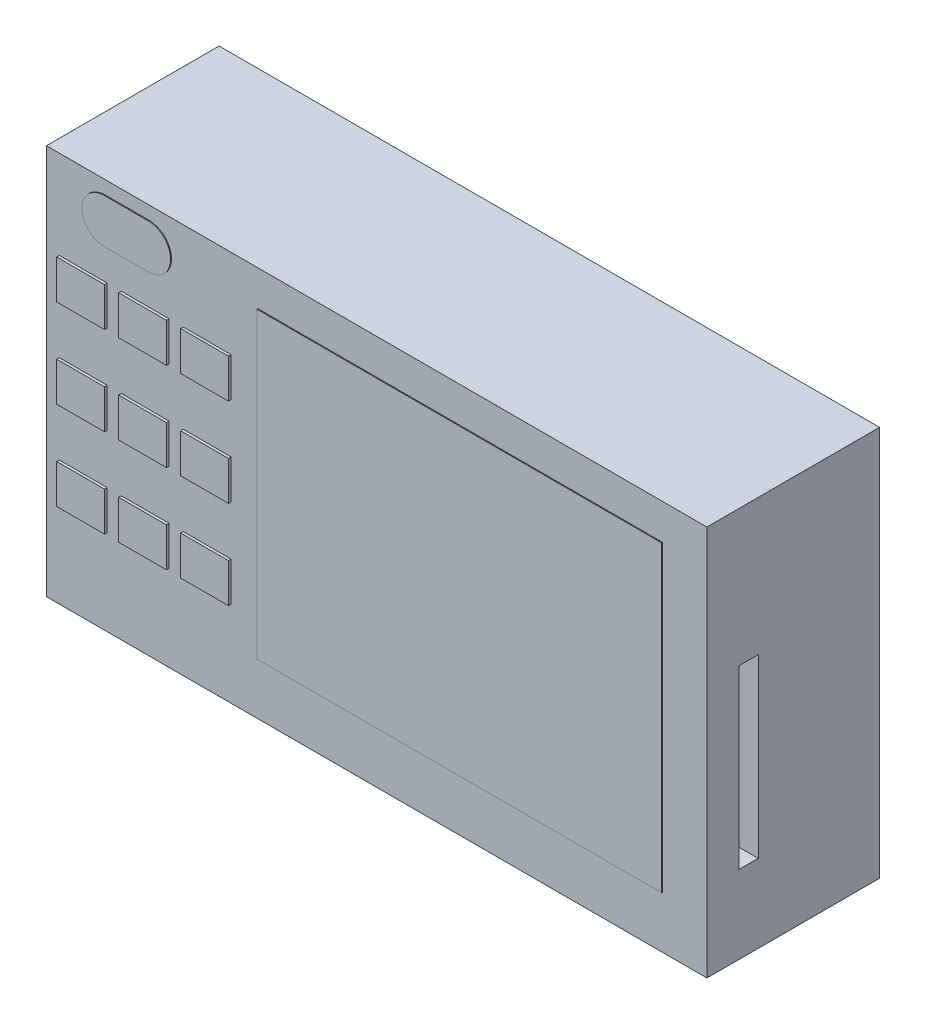
from build123d import *

# Parameters (mm, degrees)
SKETCH1_W                 = 94.7166
SKETCH1_H                 = 56.007
EXTRUDE1_DEPTH            = 24.765
SKETCH2_W                 = 58.0644
SKETCH2_H                 = 43.4594
EXTRUDE2_DEPTH            = 0.127
SKETCH3_W                 = 6.858
SKETCH3_H                 = 5.588
EXTRUDE3_DEPTH            = 0.381
LPATTERN1_COUNT           = 3
LPATTERN1_PITCH           = 8.89
LPATTERN2_COUNT           = 3
LPATTERN2_PITCH           = 12.7
LPATTERN2_COPY_1_SKETCH_W = 6.858
LPATTERN2_COPY_1_SKETCH_H = 5.588
LPATTERN2_COPY_1_DEPTH    = 0.381
LPATTERN2_COPY_2_SKETCH_W = 6.858
LPATTERN2_COPY_2_SKETCH_H = 5.588
LPATTERN2_COPY_2_DEPTH    = 0.381
LPATTERN2_COPY_3_SKETCH_W = 6.858
LPATTERN2_COPY_3_SKETCH_H = 5.588
LPATTERN2_COPY_3_DEPTH    = 0.381
LPATTERN2_COPY_4_SKETCH_W = 6.858
LPATTERN2_COPY_4_SKETCH_H = 5.588
LPATTERN2_COPY_4_DEPTH    = 0.381
SKETCH4_R                 = 1.524
SKETCH4_R_2               = 2.54
SKETCH4_W                 = 4.953
SKETCH4_H                 = 16.51
SKETCH4_W_2               = 7.62
SKETCH4_H_2               = 21.59
EXTRUDE4_DEPTH            = 0.381
SKETCH5_R                 = 2.286
SKETCH5_W                 = 15.24
SKETCH5_H                 = 4.572
SKETCH5_W_2               = 12.7
SKETCH5_W_3               = 25.4
SKETCH5_H_2               = 6.604
EXTRUDE5_DEPTH            = 0.381
SKETCH6_W                 = 2.794
SKETCH6_H                 = 25.2984
EXTRUDE6_DEPTH            = 28.321


with BuildPart() as part:
    # Sketch1 → Extrude1 (new body)
    with BuildSketch(Plane.XY):
        Rectangle(SKETCH1_W, SKETCH1_H)
    extrude(amount=EXTRUDE1_DEPTH)

    # Sketch2 → Extrude2 (add)
    with BuildSketch(Plane.XY.offset(24.765)):
        with Locations((11.9761, 1.1938)):
            Rectangle(SKETCH2_W, SKETCH2_H)
        with BuildLine():
            Line((-38.950442947, 26.0985), (-32.600442947, 26.0985))
            ThreePointArc((-32.600442947, 26.0985), (-29.425442947, 22.9235), (-32.600442947, 19.7485))
            Line((-32.600442947, 19.7485), (-38.950442947, 19.7485))
            ThreePointArc((-38.950442947, 19.7485), (-42.125442947, 22.9235), (-38.950442947, 26.0985))
        make_face()
    extrude(amount=EXTRUDE2_DEPTH)

    # Sketch3 → Extrude3 (add)
    with BuildSketch(Plane.XY.offset(24.765)):
        with Locations((-24.2951, 12.5095)):
            Rectangle(SKETCH3_W, SKETCH3_H)
    extrude3 = extrude(amount=EXTRUDE3_DEPTH)

    # LPattern1: Extrude3 ×3
    with Locations(*[(-i * LPATTERN1_PITCH, 0, 0) for i in range(1, LPATTERN1_COUNT)]):
        add(extrude3)

    # LPattern2: Extrude3 ×3
    with Locations(*[(0, -i * LPATTERN2_PITCH, 0) for i in range(1, LPATTERN2_COUNT)]):
        add(extrude3)

    # LPattern2 copy 1 sketch → LPattern2 copy 1 (add)
    with BuildSketch(Plane(origin=(-8.89, -12.7, 24.765), x_dir=(1, 0, 0), z_dir=(0, 0, 1))):
        with Locations((-24.2951, 12.5095)):
            Rectangle(LPATTERN2_COPY_1_SKETCH_W, LPATTERN2_COPY_1_SKETCH_H)
    extrude(amount=LPATTERN2_COPY_1_DEPTH)

    # LPattern2 copy 2 sketch → LPattern2 copy 2 (add)
    with BuildSketch(Plane(origin=(-8.89, -25.4, 24.765), x_dir=(1, 0, 0), z_dir=(0, 0, 1))):
        with Locations((-24.2951, 12.5095)):
            Rectangle(LPATTERN2_COPY_2_SKETCH_W, LPATTERN2_COPY_2_SKETCH_H)
    extrude(amount=LPATTERN2_COPY_2_DEPTH)

    # LPattern2 copy 3 sketch → LPattern2 copy 3 (add)
    with BuildSketch(Plane(origin=(-17.78, -12.7, 24.765), x_dir=(1, 0, 0), z_dir=(0, 0, 1))):
        with Locations((-24.2951, 12.5095)):
            Rectangle(LPATTERN2_COPY_3_SKETCH_W, LPATTERN2_COPY_3_SKETCH_H)
    extrude(amount=LPATTERN2_COPY_3_DEPTH)

    # LPattern2 copy 4 sketch → LPattern2 copy 4 (add)
    with BuildSketch(Plane(origin=(-17.78, -25.4, 24.765), x_dir=(1, 0, 0), z_dir=(0, 0, 1))):
        with Locations((-24.2951, 12.5095)):
            Rectangle(LPATTERN2_COPY_4_SKETCH_W, LPATTERN2_COPY_4_SKETCH_H)
    extrude(amount=LPATTERN2_COPY_4_DEPTH)

    # Sketch4 → Extrude4 (add)
    with BuildSketch(Plane.ZY.offset(47.3583)):
        with Locations(Location((12.192, -6.4135, 0), (0, 0, 180))):
            Circle(SKETCH4_R)
        with Locations(Location((12.192, -16.3195, 0), (0, 0, 180))):
            Circle(SKETCH4_R_2)
        with Locations((21.427500813, 9.5885)):
            Rectangle(SKETCH4_W, SKETCH4_H)
        with Locations((10.922, 10.9855)):
            Rectangle(SKETCH4_W_2, SKETCH4_H_2)
    extrude(amount=EXTRUDE4_DEPTH)

    # Sketch5 → Extrude5 (add)
    with BuildSketch(Plane.XZ.offset(28.0035)):
        with Locations(Location((-9.2583, 14.351, 0), (0, 0, 90))):
            Circle(SKETCH5_R)
        with Locations((-24.4983, 14.097)):
            Rectangle(SKETCH5_W, SKETCH5_H)
        with Locations((4.7117, 14.097)):
            Rectangle(SKETCH5_W_2, SKETCH5_H)
        with Locations((25.5397, 13.081)):
            Rectangle(SKETCH5_W_3, SKETCH5_H_2)
    extrude(amount=EXTRUDE5_DEPTH)

    # Sketch6 → Extrude6 (cut)
    with BuildSketch(Plane(origin=(47.3583, 0, 0), x_dir=(0, 0, -1), z_dir=(1, 0, 0))):
        with Locations((-18.796, -4.1783)):
            Rectangle(SKETCH6_W, SKETCH6_H)
    extrude(amount=-EXTRUDE6_DEPTH, mode=Mode.SUBTRACT)


solid = part.part
